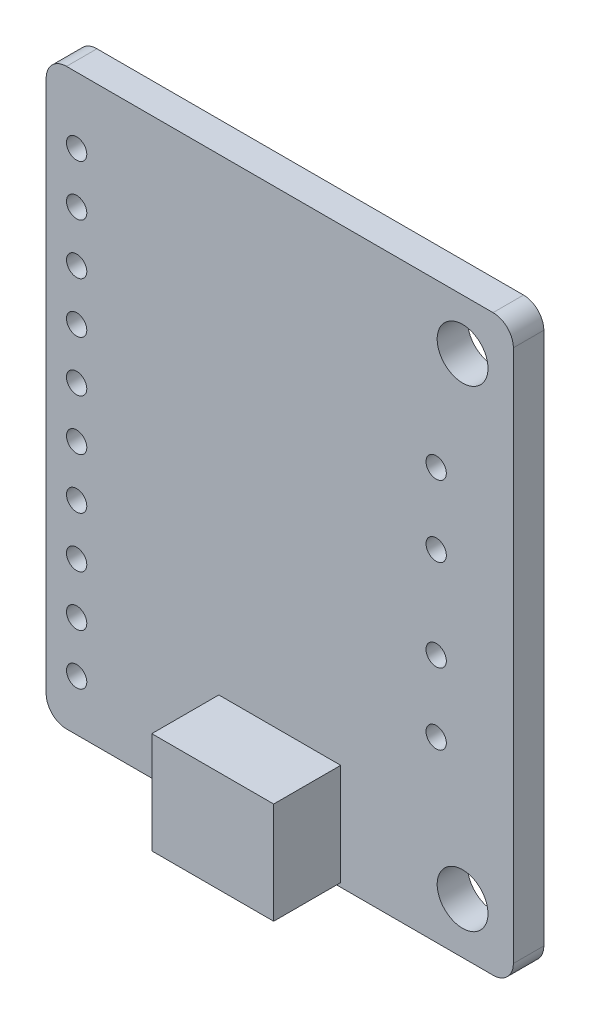
from build123d import *

# Parameters (mm, degrees)
BOSS_EXTRUDE1_DEPTH  = 1.5
SKETCH2_R            = 1.25
CUT_EXTRUDE1_DEPTH   = 19.276094358
SKETCH3_R            = 0.5
CUT_EXTRUDE2_DEPTH   = 19.276094358
LPATTERN1_COUNT      = 10
LPATTERN1_PITCH      = 2.5
SKETCH4_W            = 6
SKETCH4_H            = 5
GAIN_SWITCH_DEPTH    = 3.3
SKETCH5_R            = 0.5
CUT_EXTRUDE3_DEPTH   = 19.510959592
LPATTERN2_COUNT      = 2
LPATTERN2_PITCH      = 3.5
LPATTERN2_COUNT_DIR2 = 2
LPATTERN2_PITCH_DIR2 = 8


with BuildPart() as part:
    # Sketch1 → Boss-Extrude1 (new body)
    with BuildSketch(Plane.XY):
        with BuildLine():
            Line((-10.5, -14.125), (10.5, -14.125))
            ThreePointArc((10.5, -14.125), (11.207106781, -13.832106781), (11.5, -13.125))
            Line((11.5, -13.125), (11.5, 13.125))
            ThreePointArc((11.5, 13.125), (11.207106781, 13.832106781), (10.5, 14.125))
            Line((10.5, 14.125), (-10.5, 14.125))
            ThreePointArc((-10.5, 14.125), (-11.207106781, 13.832106781), (-11.5, 13.125))
            Line((-11.5, 13.125), (-11.5, -13.125))
            ThreePointArc((-11.5, -13.125), (-11.207106781, -13.832106781), (-10.5, -14.125))
        make_face()
    extrude(amount=BOSS_EXTRUDE1_DEPTH)

    # Sketch2 → Cut-Extrude1 (cut, through all)
    with BuildSketch(Plane.XY.offset(1.5)):
        with Locations((9, 11.625)):
            Circle(SKETCH2_R)
    cut_extrude1 = extrude(amount=-CUT_EXTRUDE1_DEPTH, mode=Mode.SUBTRACT)

    # Mirror1: Cut-Extrude1 across plane
    add(cut_extrude1.mirror(Plane.ZX), mode=Mode.SUBTRACT)

    # Sketch3 → Cut-Extrude2 (cut, through all)
    with BuildSketch(Plane.XY.offset(1.5)):
        with Locations((-10, -11.625)):
            Circle(SKETCH3_R)
    cut_extrude2 = extrude(amount=-CUT_EXTRUDE2_DEPTH, mode=Mode.SUBTRACT)

    # LPattern1: Cut-Extrude2 ×10
    with Locations(*[(0, i * LPATTERN1_PITCH, 0) for i in range(1, LPATTERN1_COUNT)]):
        add(cut_extrude2, mode=Mode.SUBTRACT)

    # Sketch4 → Gain Switch (add)
    with BuildSketch(Plane.XY.offset(1.5)):
        with Locations((0, -11.425)):
            Rectangle(SKETCH4_W, SKETCH4_H)
    extrude(amount=GAIN_SWITCH_DEPTH)

    # Sketch5 → Cut-Extrude3 (cut, through all)
    with BuildSketch(Plane.XY.offset(1.5)):
        with Locations((7.7, 6.125)):
            Circle(SKETCH5_R)
    cut_extrude3 = extrude(amount=-CUT_EXTRUDE3_DEPTH, mode=Mode.SUBTRACT)

    # LPattern2: Cut-Extrude3 2 × 2
    with Locations(*[Vector(0, -1, 0) * (i * LPATTERN2_PITCH) + Vector(0, -1, 0) * (j * LPATTERN2_PITCH_DIR2) for i in range(LPATTERN2_COUNT) for j in range(LPATTERN2_COUNT_DIR2) if (i, j) != (0, 0)]):
        add(cut_extrude3, mode=Mode.SUBTRACT)


solid = part.part
